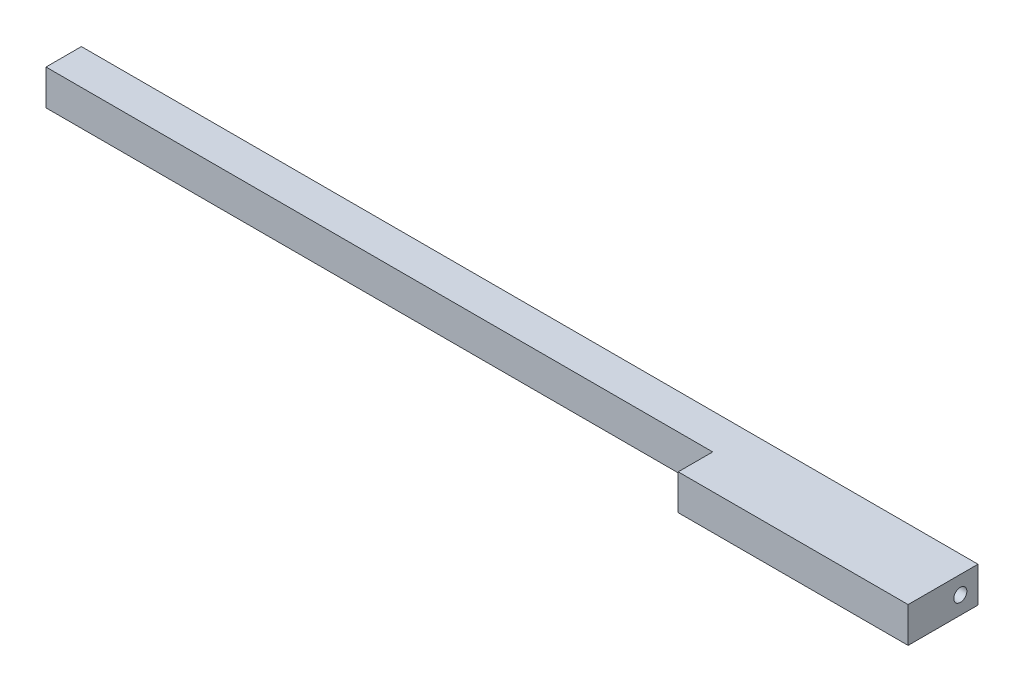
from build123d import *

# Parameters (mm, degrees)
BOSS_EXTRUDE1_DEPTH      = 457.2
BOSS_EXTRUDE1_DEPTH_BACK = 38.1
SKETCH1_W                = 19.558
SKETCH1_H                = 19.558
SKETCH2_R                = 3.6195
CUT_EXTRUDE1_DEPTH       = 38.1
SKETCH3_W                = 127
SKETCH3_H                = 19.558
BOSS_EXTRUDE2_DEPTH      = 19.05


with BuildPart() as part:
    # Sketch1 → Boss-Extrude1 (new, two sides: drawn at the far end of the back side and taken through both)
    with BuildSketch(Plane.ZY.offset(17.272).offset(-BOSS_EXTRUDE1_DEPTH_BACK)):
        with Locations((44.45, 101.6)):
            Rectangle(SKETCH1_W, SKETCH1_H)
    extrude(amount=BOSS_EXTRUDE1_DEPTH + BOSS_EXTRUDE1_DEPTH_BACK)

    # Sketch2 → Cut-Extrude1 (cut)
    with BuildSketch(Plane(origin=(20.828, 0, 0), x_dir=(0, 0, -1), z_dir=(1, 0, 0))):
        with Locations((-44.45, 101.6)):
            Circle(SKETCH2_R)
    extrude(amount=-CUT_EXTRUDE1_DEPTH, mode=Mode.SUBTRACT)

    # Sketch3 → Boss-Extrude2 (add)
    with BuildSketch(Plane.XY.offset(54.229)):
        with Locations((-42.672, 101.6)):
            Rectangle(SKETCH3_W, SKETCH3_H)
    extrude(amount=BOSS_EXTRUDE2_DEPTH)


solid = part.part
